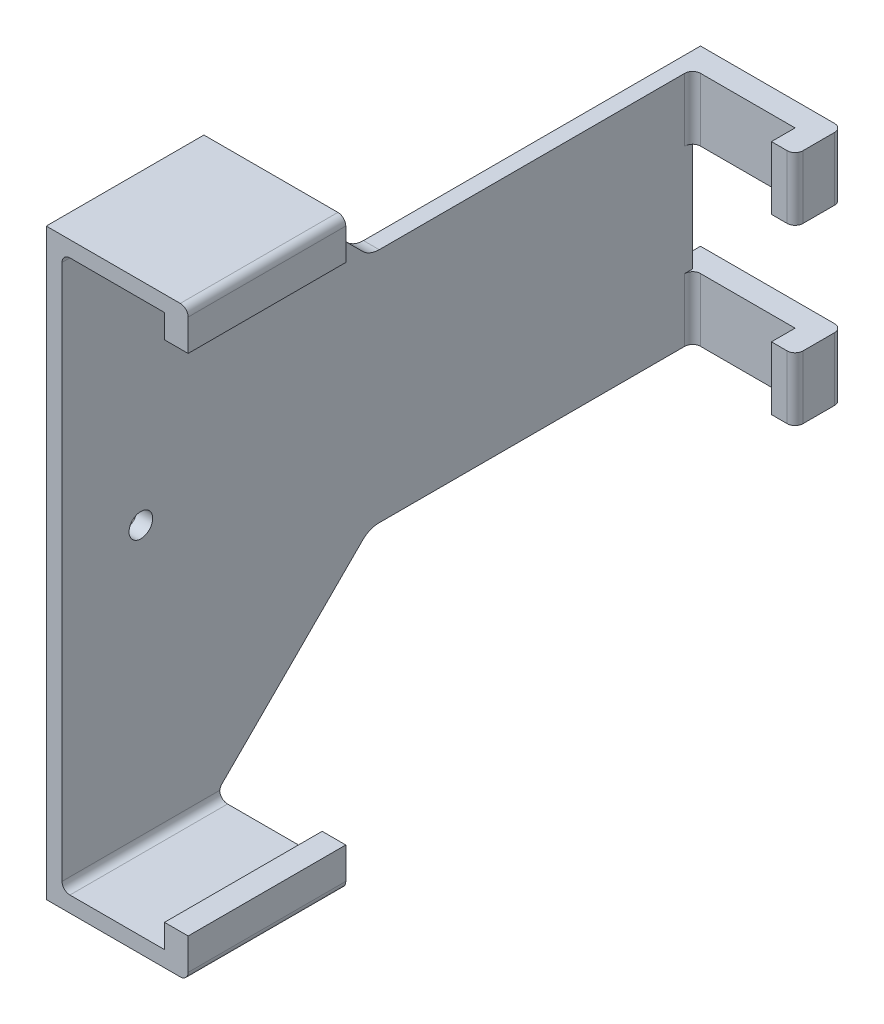
from build123d import *

# Parameters (mm, degrees)
RESSALTO_EXTRUS_O1_DEPTH = 20
ESBO_O2_W                = 2
ESBO_O2_H                = 30
RESSALTO_EXTRUS_O2_DEPTH = 60
RESSALTO_EXTRUS_O3_DEPTH = 8
FILETE1_R                = 1
ESBO_O4_R                = 1.5
CORTE_EXTRUS_O1_DEPTH    = 8
CHANFRO1_SIZE            = 19
FILETE2_R                = 3
FILETE3_R                = 1


with BuildPart() as part:
    # Esboço1 → Ressalto-extrusão1 (new body)
    with BuildSketch(Plane.XY):
        Polygon((-4.205798406, -35.280489631), (-4.205798406, 34.719510369), (8.794201594, 34.719510369), (8.794201594, 31.719510369), (11.794201594, 31.719510369), (11.794201594, 36.719510369), (-6.205798406, 36.719510369), (-6.205798406, -37.280489631), (11.794201594, -37.280489631), (11.794201594, -32.280489631), (8.794201594, -32.280489631), (8.794201594, -35.280489631), align=None)
    extrude(amount=RESSALTO_EXTRUS_O1_DEPTH)

    # Esboço2 → Ressalto-extrusão2 (add)
    with BuildSketch(Plane(origin=(0, 0, 0), x_dir=(-1, 0, 0), z_dir=(0, 0, -1))):
        with Locations((5.205798406, 0)):
            Rectangle(ESBO_O2_W, ESBO_O2_H)
    extrude(amount=RESSALTO_EXTRUS_O2_DEPTH)

    # Esboço3 → Ressalto-extrusão3 (add)
    with BuildSketch(Plane(origin=(0, 15, 0), x_dir=(1, 0, 0), z_dir=(0, 1, 0))):
        Polygon((-6.205798406, 60), (-6.205798406, 63), (11.794201594, 63), (11.794201594, 57), (8.794201594, 57), (8.794201594, 60), align=None)
    ressalto_extrus_o3 = extrude(amount=-RESSALTO_EXTRUS_O3_DEPTH)

    # Espelhar1: Ressalto-extrusão3 across plane
    add(ressalto_extrus_o3.mirror(Plane.ZX))

    # Filete1
    filete1_edges = [part.edges().sort_by_distance(p)[0] for p in [
        (-4.205798406, 34.719510369, 10),
        (-4.205798406, -35.280489631, 10),
        (11.794201594, -37.280489631, 10),
        (11.794201594, 36.719510369, 10),
        (-4.205798406, 11, -60),
        (11.794201594, 11, -63),
        (11.794201594, 11, -57),
        (-4.205798406, -11, -60),
        (11.794201594, -11, -57),
        (11.794201594, -11, -63),
    ]]
    fillet(filete1_edges, radius=FILETE1_R)

    # Esboço4 → Corte-extrusão1 (cut)
    with BuildSketch(Plane(origin=(-4.205798406, 0, 0), x_dir=(0, 0, -1), z_dir=(1, 0, 0))):
        with Locations(Location((-10, -0.140244815, 0), (0, 0, 90))):
            Circle(ESBO_O4_R)
    extrude(amount=-CORTE_EXTRUS_O1_DEPTH, mode=Mode.SUBTRACT)

    # Chanfro1
    chanfro1_edges = [part.edges().sort_by_distance(p)[0] for p in [
        (-5.205798406, -15, 0),
        (-5.205798406, 15, 0),
    ]]
    chamfer(chanfro1_edges, length=CHANFRO1_SIZE)

    # Filete2
    filete2_edges = [part.edges().sort_by_distance(p)[0] for p in [
        (-5.205798406, -15, -19),
        (-5.205798406, 15, -19),
    ]]
    fillet(filete2_edges, radius=FILETE2_R)

    # Filete3
    filete3_edges = [part.edges().sort_by_distance(p)[0] for p in [
        (-5.205798406, -34, 0),
        (-5.185726934, 34, 0),
    ]]
    fillet(filete3_edges, radius=FILETE3_R)


solid = part.part
